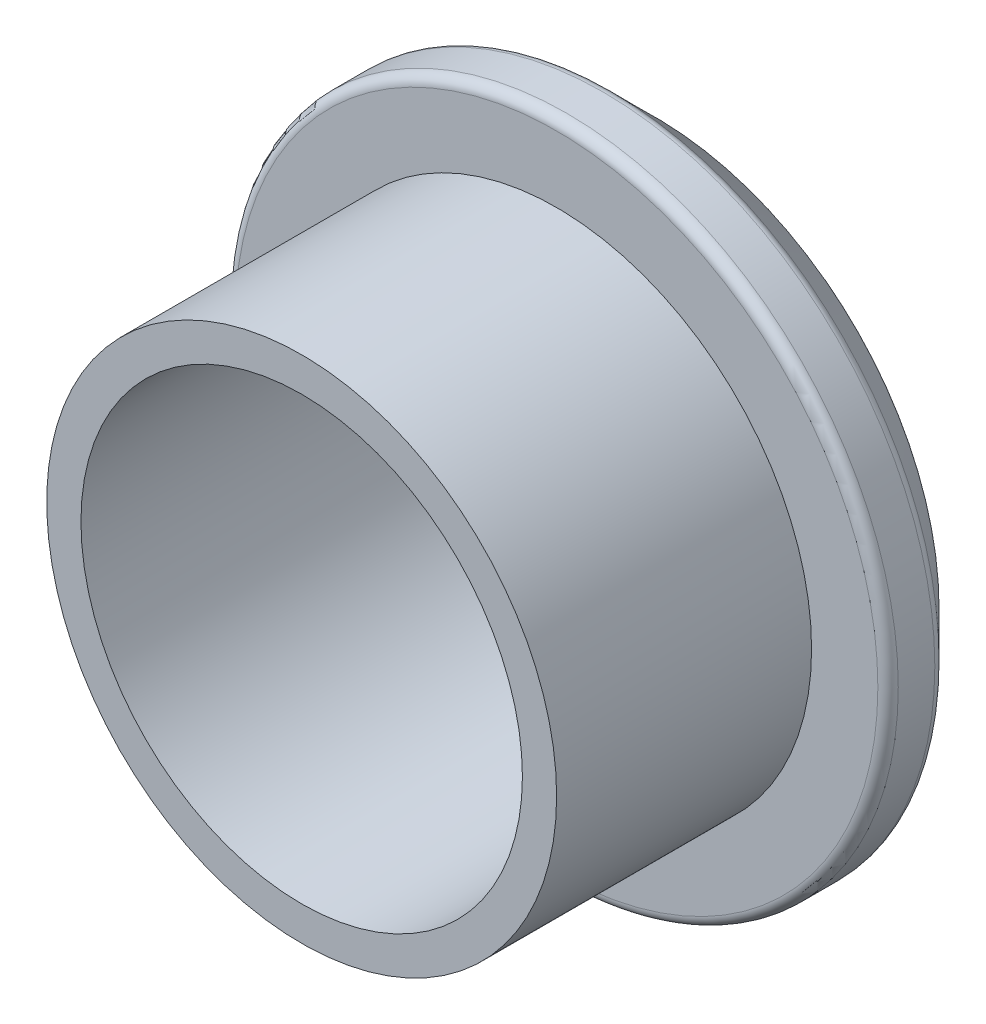
from build123d import *

# Parameters (mm, degrees)
SKETCH1_R           = 10
SKETCH1_R_2         = 8.657914019
BOSS_EXTRUDE1_DEPTH = 10
BOSS_EXTRUDE2_START = -4
SKETCH1_3_R         = 13
SKETCH1_3_R_2       = 8.657914019
BOSS_EXTRUDE2_DEPTH = 4
CHAMFER1_SIZE       = 2
FILLET1_R           = 0.4
FILLET2_R           = 0.4
FILLET3_R           = 0.4


with BuildPart() as part:
    # Sketch1 → Boss-Extrude1 (new body)
    with BuildSketch(Plane.XY):
        Circle(SKETCH1_R)
        Circle(SKETCH1_R_2, mode=Mode.SUBTRACT)
    extrude(amount=BOSS_EXTRUDE1_DEPTH)

    # Sketch1<3> → Boss-Extrude2 (add)
    with BuildSketch(Plane.XY.offset(BOSS_EXTRUDE2_START)):
        Circle(SKETCH1_3_R)
        Circle(SKETCH1_3_R_2, mode=Mode.SUBTRACT)
    extrude(amount=BOSS_EXTRUDE2_DEPTH)

    # Chamfer1
    chamfer1_edges = [part.edges().sort_by_distance(p)[0] for p in [
        (-13, 0, -4),
    ]]
    chamfer(chamfer1_edges, length=CHAMFER1_SIZE)

    # Fillet1
    fillet1_edges = [part.edges().sort_by_distance(p)[0] for p in [
        (-8.657914019, 0, -4),
    ]]
    fillet(fillet1_edges, radius=FILLET1_R)

    # Fillet2
    fillet2_edges = [part.edges().sort_by_distance(p)[0] for p in [
        (-13, 0, -2),
        (-11, 0, -4),
    ]]
    fillet(fillet2_edges, radius=FILLET2_R)

    # Fillet3
    fillet3_edges = [part.edges().sort_by_distance(p)[0] for p in [
        (-13, 0, 0),
    ]]
    fillet(fillet3_edges, radius=FILLET3_R)


solid = part.part
